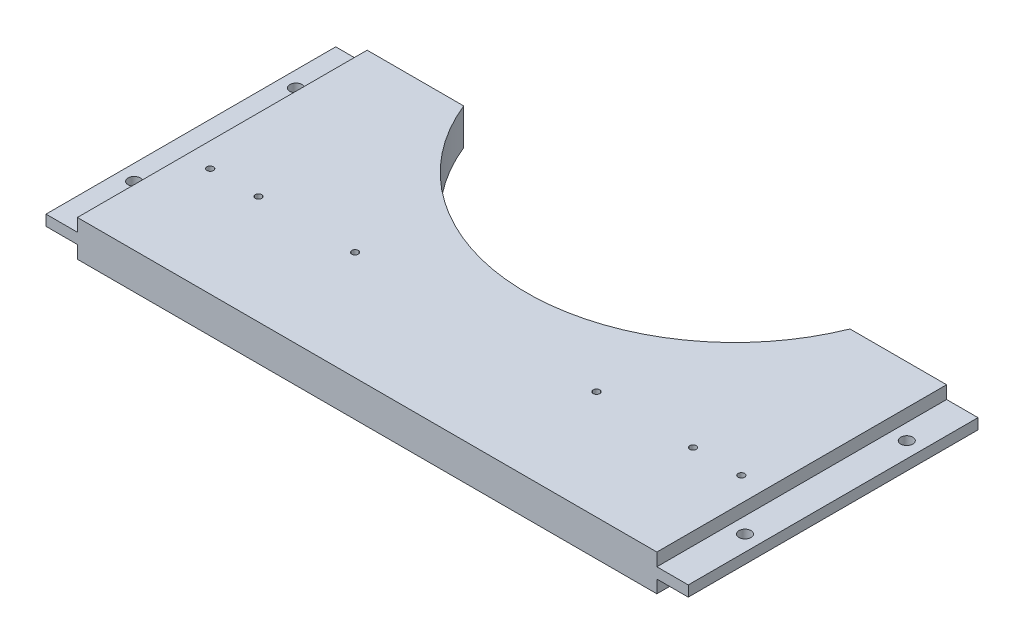
from build123d import *

# Parameters (mm, degrees)
BOSS_EXTRUDE1_DEPTH         = 9.525
F_8_32_TAPPED_HOLE1_D       = 3.4544
SKETCH6_W                   = 16.51
SKETCH6_H                   = 152.4
BOSS_EXTRUDE2_DEPTH         = 2.794
F_1_4_0_25_DIAMETER_HOLE1_D = 6.35


with BuildPart() as part:
    # Sketch1 → Boss-Extrude1 (new, symmetric)
    with BuildSketch(Plane(origin=(0, 0, 0), x_dir=(1, 0, 0), z_dir=(0, 1, 0))):
        with BuildLine():
            ThreePointArc((0, 7.62), (-61.289836841, 26.369500976), (-101.6, 76.2))
            Line((-101.6, 76.2), (-152.4, 76.2))
            Line((-152.4, 76.2), (-152.4, -76.2))
            Line((-152.4, -76.2), (152.4, -76.2))
            Line((152.4, -76.2), (152.4, 76.2))
            Line((152.4, 76.2), (101.6, 76.2))
            ThreePointArc((101.6, 76.2), (61.289836841, 26.369500976), (0, 7.62))
        make_face()
    extrude(amount=BOSS_EXTRUDE1_DEPTH, both=True)

    # #8-32 Tapped Hole1 (through all)
    with Locations(Plane(origin=(0, 9.525, 0), x_dir=(1, 0, 0), z_dir=(0, 1, 0))):
        with Locations((-139.7, -19.05), (-114.3, -19.05), (-63.5, -19.05)):
            f_8_32_tapped_hole1 = Hole(F_8_32_TAPPED_HOLE1_D / 2)

    # Mirror1: #8-32 Tapped Hole1 across plane
    add(f_8_32_tapped_hole1.mirror(Plane(origin=(0, 0, 0), x_dir=(0, 0, 1), z_dir=(1, 0, 0))), mode=Mode.SUBTRACT)

    # Sketch6 → Boss-Extrude2 (add, symmetric)
    with BuildSketch(Plane(origin=(0, 0, 0), x_dir=(1, 0, 0), z_dir=(0, 1, 0))):
        with Locations((-160.655, 0)):
            Rectangle(SKETCH6_W, SKETCH6_H)
    boss_extrude2 = extrude(amount=BOSS_EXTRUDE2_DEPTH, both=True)

    # 1/4 (0.25) Diameter Hole1 (through all)
    with Locations(Plane(origin=(0, 2.794, 0), x_dir=(1, 0, 0), z_dir=(0, 1, 0))):
        with Locations((-160.655, 46.99), (-160.655, -38.1)):
            f_1_4_0_25_diameter_hole1 = Hole(F_1_4_0_25_DIAMETER_HOLE1_D / 2)

    # Mirror2: Boss-Extrude2, 1/4 (0.25) Diameter Hole1 across plane
    add(boss_extrude2.mirror(Plane(origin=(0, 0, 0), x_dir=(0, 0, 1), z_dir=(1, 0, 0))))
    add(f_1_4_0_25_diameter_hole1.mirror(Plane(origin=(0, 0, 0), x_dir=(0, 0, 1), z_dir=(1, 0, 0))), mode=Mode.SUBTRACT)


solid = part.part
